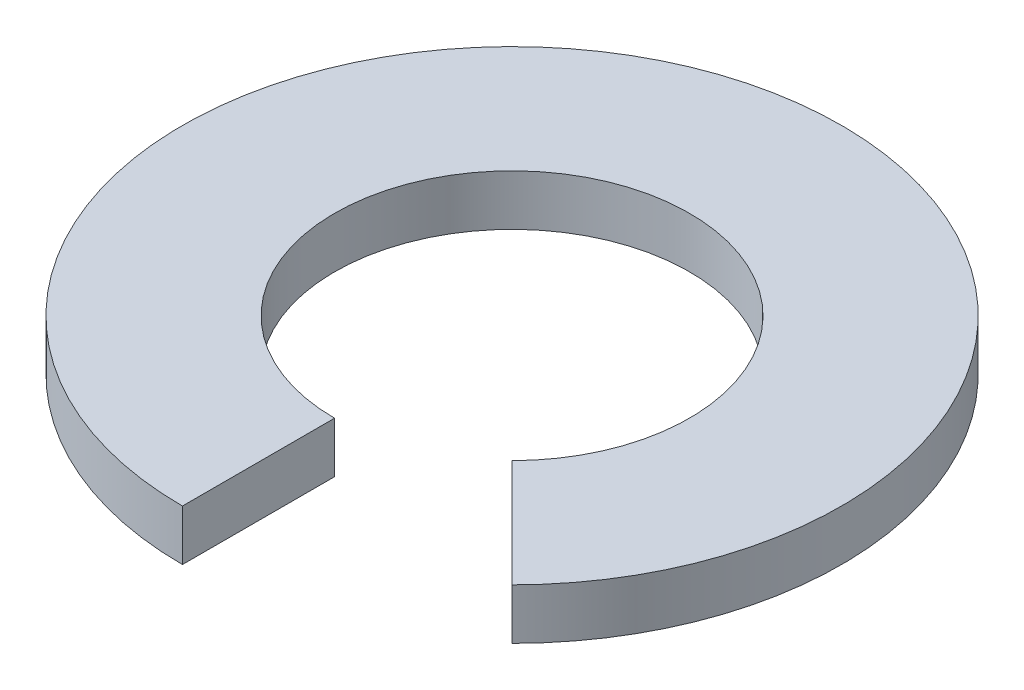
from build123d import *

# Parameters (mm, degrees)
SALIENTE_EXTRUIR1_DEPTH = 1


with BuildPart() as part:
    # Croquis1 → Saliente-Extruir1 (new body)
    with BuildSketch(Plane(origin=(0, 0, 0), x_dir=(1, 0, 0), z_dir=(0, 1, 0))):
        with BuildLine():
            Line((0, -3.5), (0, -6.5))
            ThreePointArc((0, -6.5), (-2.48744231, 6.005216961), (4.596194078, -4.596194078))
            Line((4.596194078, -4.596194078), (2.474873734, -2.474873734))
            ThreePointArc((2.474873734, -2.474873734), (-1.339392013, 3.233578364), (0, -3.5))
        make_face()
    extrude(amount=SALIENTE_EXTRUIR1_DEPTH)


solid = part.part
